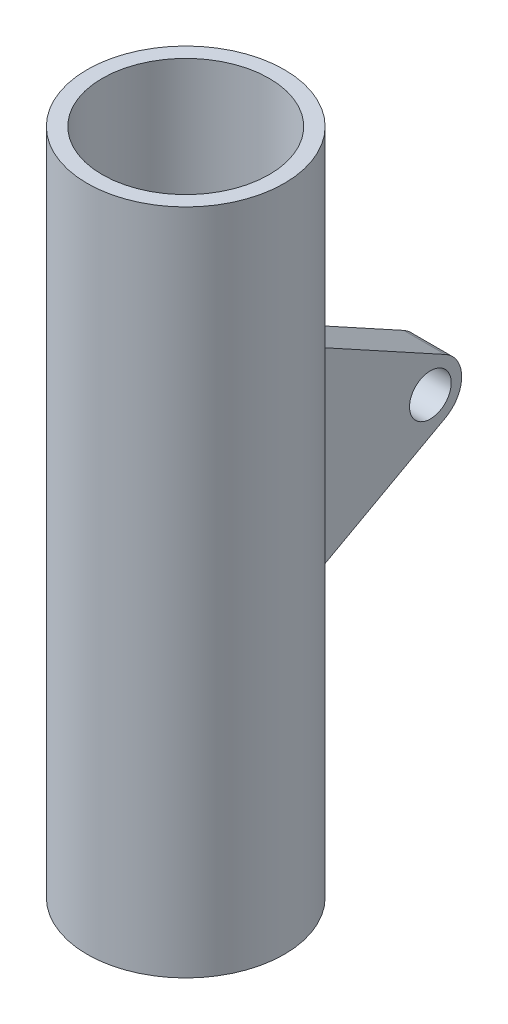
from build123d import *

# Parameters (mm, degrees)
SKETCH1_R                            = 30
SKETCH1_R_2                          = 25.4
BOSS_EXTRUDE1_DEPTH                  = 203.2
SKETCH2_W                            = 12.7
SKETCH2_H                            = 63.5
BOSS_EXTRUDE2_DEPTH                  = 50.8
BOSS_EXTRUDE2_DIRECTION_2_REACH      = 215.987
BOSS_EXTRUDE2_DIRECTION_2_END_RADIUS = 30
CUT_EXTRUDE3_REACH                   = 223.676
SKETCH3_R                            = 6.35
CUT_EXTRUDE3_DIRECTION_2_DEPTH       = 222.675895171


with BuildPart() as part:
    # Sketch1 → Boss-Extrude1 (new body)
    with BuildSketch(Plane(origin=(0, 0, 0), x_dir=(1, 0, 0), z_dir=(0, 1, 0))):
        with Locations(Location((0, 0, 0), (0, 0, 270))):
            Circle(SKETCH1_R)
        with Locations(Location((0, 0, 0), (0, 0, 270))):
            Circle(SKETCH1_R_2, mode=Mode.SUBTRACT)
    extrude(amount=BOSS_EXTRUDE1_DEPTH)

    # Sketch2 → Boss-Extrude2 (add)
    with BuildSketch(Plane(origin=(0, 0, -30), x_dir=(-1, 0, 0), z_dir=(0, 0, -1))):
        with Locations((0, 101.6)):
            Rectangle(SKETCH2_W, SKETCH2_H)
    extrude(amount=BOSS_EXTRUDE2_DEPTH)

    # Boss-Extrude2 direction 2: up to this cylinder (the profile starts outside it)
    boss_extrude2_direction_2_end = Plane(origin=(0, 101.6, 0), z_dir=(0, -1, 0)) * Cylinder(BOSS_EXTRUDE2_DIRECTION_2_END_RADIUS, 492.974, mode=Mode.PRIVATE)
    # Sketch2 → Boss-Extrude2 direction 2 (add, up to the surface)
    with BuildSketch(Plane(origin=(0, 0, -30), x_dir=(-1, 0, 0), z_dir=(0, 0, -1)), mode=Mode.PRIVATE) as boss_extrude2_direction_2_sk1:
        with Locations((0, 101.6)):
            Rectangle(SKETCH2_W, SKETCH2_H)
    boss_extrude2_direction_2_tool1 = extrude(boss_extrude2_direction_2_sk1.sketch, amount=-BOSS_EXTRUDE2_DIRECTION_2_REACH, mode=Mode.PRIVATE) - boss_extrude2_direction_2_end
    add(boss_extrude2_direction_2_tool1.solids().sort_by_distance((0, 101.6, -30))[0])
    add(boss_extrude2_direction_2_tool1.solids().sort_by_distance((0, 101.6, -30))[1])

    # Sketch3 → Cut-Extrude3 (cut, up to next)
    with BuildSketch(Plane(origin=(6.35, 0, 0), x_dir=(0, 0, -1), z_dir=(1, 0, 0)), mode=Mode.PRIVATE) as cut_extrude3_sk1:
        with BuildLine():
            Line((72.678913322, 93.247804014), (30, 69.85))
            Line((30, 69.85), (80.8, 69.85))
            Line((80.8, 69.85), (80.8, 133.35))
            Line((80.8, 133.35), (30, 133.35))
            Line((30, 133.35), (72.678913322, 109.952195986))
            ThreePointArc((72.678913322, 109.952195986), (76.295723714, 106.453425368), (77.625, 101.6))
            ThreePointArc((77.625, 101.6), (76.295723714, 96.746574632), (72.678913322, 93.247804014))
        make_face()
    cut_extrude3_tool1 = extrude(cut_extrude3_sk1.sketch, amount=-CUT_EXTRUDE3_REACH, mode=Mode.PRIVATE) & part.part
    # Sketch3 → Cut-Extrude3 (cut, up to next)
    with BuildSketch(Plane(origin=(6.35, 0, 0), x_dir=(0, 0, -1), z_dir=(1, 0, 0)), mode=Mode.PRIVATE) as cut_extrude3_sk2:
        with Locations((68.1, 101.6)):
            Circle(SKETCH3_R)
    cut_extrude3_tool2 = extrude(cut_extrude3_sk2.sketch, amount=-CUT_EXTRUDE3_REACH, mode=Mode.PRIVATE) & part.part
    add(cut_extrude3_tool1.solids().sort_by_distance((6.35, 80.835833, -51.730381))[0], mode=Mode.SUBTRACT)
    add(cut_extrude3_tool2.solids().sort_by_distance((6.35, 101.6, -68.1))[0], mode=Mode.SUBTRACT)

    # Sketch3 → Cut-Extrude3 direction 2 (cut)
    with BuildSketch(Plane(origin=(6.35, 0, 0), x_dir=(0, 0, -1), z_dir=(1, 0, 0))):
        with BuildLine():
            Line((72.678913322, 93.247804014), (30, 69.85))
            Line((30, 69.85), (80.8, 69.85))
            Line((80.8, 69.85), (80.8, 133.35))
            Line((80.8, 133.35), (30, 133.35))
            Line((30, 133.35), (72.678913322, 109.952195986))
            ThreePointArc((72.678913322, 109.952195986), (76.295723714, 106.453425368), (77.625, 101.6))
            ThreePointArc((77.625, 101.6), (76.295723714, 96.746574632), (72.678913322, 93.247804014))
        make_face()
        with Locations((68.1, 101.6)):
            Circle(SKETCH3_R)
    extrude(amount=CUT_EXTRUDE3_DIRECTION_2_DEPTH, mode=Mode.SUBTRACT)


solid = part.part
